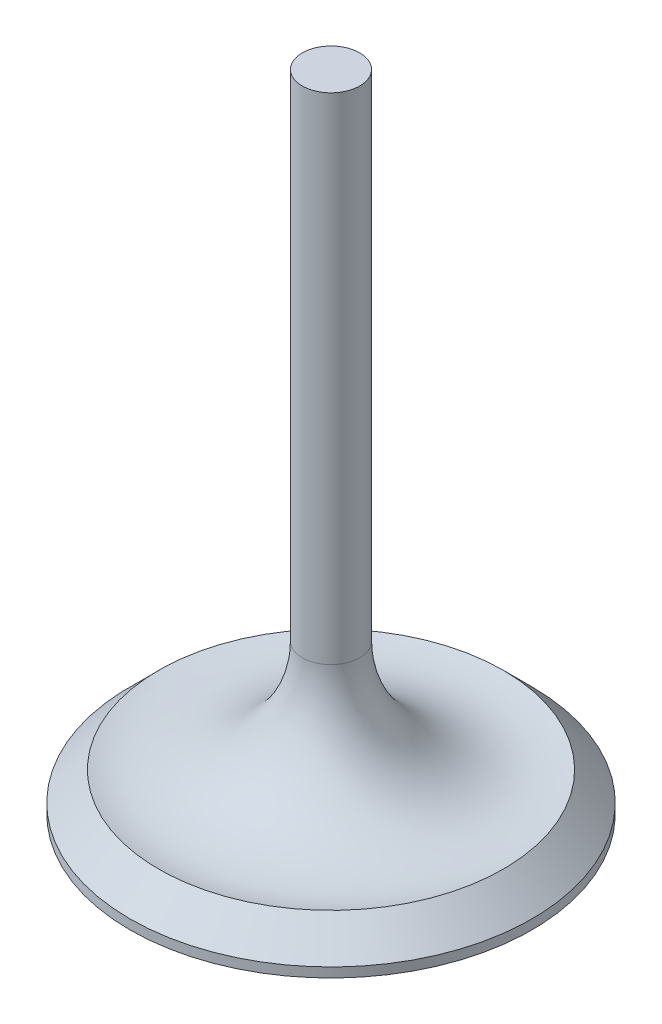
from build123d import *


with BuildPart() as part:
    # Sketch1 → Revolve1 (revolve)
    with BuildSketch(Plane.XY, mode=Mode.PRIVATE) as revolve1_sk:
        with BuildLine():
            Line((0, 0), (0, 85.55))
            Line((0, 85.55), (3.81, 85.55))
            Line((3.81, 85.55), (3.81, 19.848970851))
            ThreePointArc((3.81, 19.848970851), (9.716218646, 7.796740767), (22.86, 5.08))
            Line((22.86, 5.08), (26.67, 1.27))
            Line((26.67, 1.27), (26.67, 0))
            Line((26.67, 0), (0, 0))
        make_face()
    revolve(revolve1_sk.sketch.rotate(Axis((0, 0, 0), (0, 1, 0)), 90), axis=Axis((0, 0, 0), (0, 1, 0)))


solid = part.part
